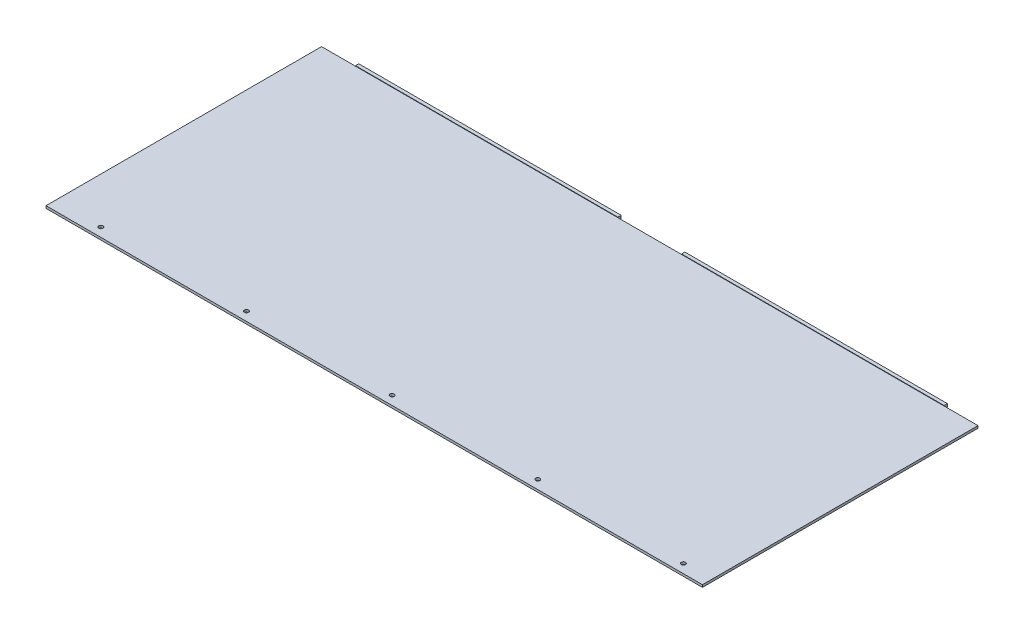
from build123d import *

# Parameters (mm, degrees)
SKETCH1_W           = 635.3556
SKETCH1_H           = 266.7
BOSS_EXTRUDE1_DEPTH = 1.143
SKETCH2_W           = 254
SKETCH2_H           = 2.7305
BOSS_EXTRUDE2_DEPTH = 3.175
CUT_EXTRUDE1_DEPTH  = 10
LPATTERN1_COUNT     = 5
LPATTERN1_PITCH     = 140.97


with BuildPart() as part:
    # Sketch1 → Boss-Extrude1 (new, symmetric)
    with BuildSketch(Plane(origin=(0, 0, 0), x_dir=(1, 0, 0), z_dir=(0, 1, 0))):
        Rectangle(SKETCH1_W, SKETCH1_H)
    extrude(amount=BOSS_EXTRUDE1_DEPTH, both=True)

    # Sketch2 → Boss-Extrude2 (add)
    with BuildSketch(Plane(origin=(0, 0, -133.35), x_dir=(-1, 0, 0), z_dir=(0, 0, -1))):
        with Locations((-157.8229, 0.22225)):
            Rectangle(SKETCH2_W, SKETCH2_H)
        with Locations((157.8229, 0.22225)):
            Rectangle(SKETCH2_W, SKETCH2_H)
    extrude(amount=BOSS_EXTRUDE2_DEPTH)

    # Sketch3 → Cut-Extrude1 (cut, symmetric)
    with BuildSketch(Plane(origin=(0, 1.143, 0), x_dir=(1, 0, 0), z_dir=(0, 1, 0))):
        with BuildLine():
            ThreePointArc((-275.2528, -124.714), (-274.659691232, -126.145891232), (-273.2278, -126.739))
            Line((-273.2278, -126.739), (-273.2278, -124.714))
            Line((-273.2278, -124.714), (-275.2528, -124.714))
        make_face()
        with BuildLine():
            Line((-273.2278, -124.714), (-273.2278, -126.739))
            ThreePointArc((-273.2278, -126.739), (-271.795908768, -126.145891232), (-271.2028, -124.714))
            ThreePointArc((-271.2028, -124.714), (-273.2278, -122.689), (-275.2528, -124.714))
            Line((-275.2528, -124.714), (-273.2278, -124.714))
        make_face()
    cut_extrude1 = extrude(amount=CUT_EXTRUDE1_DEPTH, both=True, mode=Mode.SUBTRACT)

    # LPattern1: Cut-Extrude1 ×5
    with Locations(*[(i * LPATTERN1_PITCH, 0, 0) for i in range(1, LPATTERN1_COUNT)]):
        add(cut_extrude1, mode=Mode.SUBTRACT)


solid = part.part
